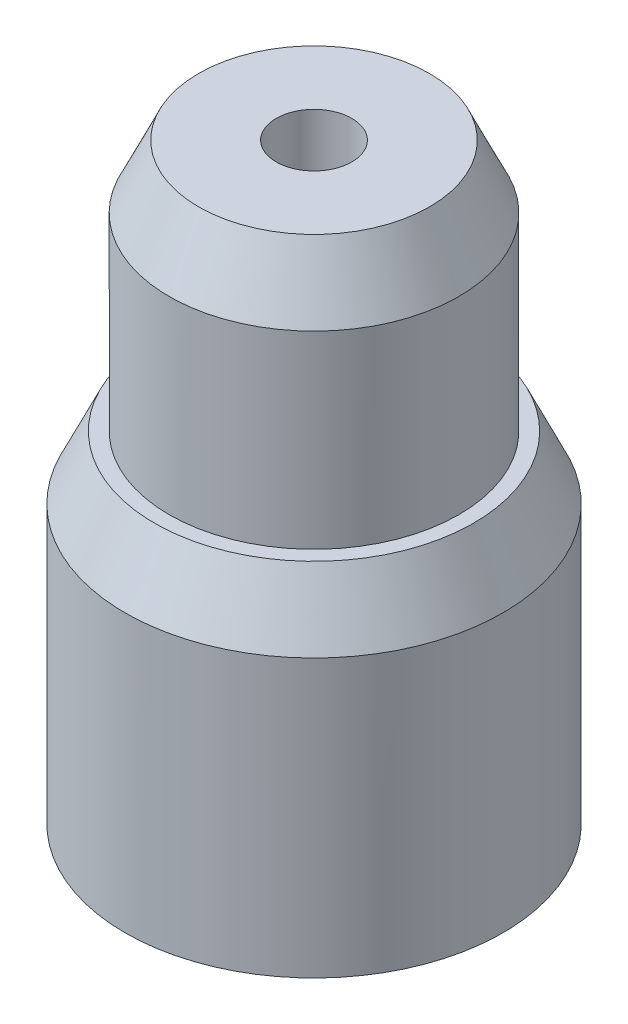
from build123d import *

# Parameters (mm, degrees)
CROQUIS1_R              = 15
SALIENTE_EXTRUIR1_DEPTH = 27
CROQUIS2_R              = 11.5
SALIENTE_EXTRUIR2_DEPTH = 20
CHAFL_N1_SIZE           = 5
CHAFL_N1_SIZE2          = 2.331538291
CHAFL_N2_SIZE           = 5
CHAFL_N2_SIZE2          = 2.331538291
CROQUIS3_R              = 5
CORTAR_EXTRUIR1_DEPTH   = 10
CROQUIS4_R              = 3
CORTAR_EXTRUIR2_DEPTH   = 10


with BuildPart() as part:
    # Croquis1 → Saliente-Extruir1 (new body)
    with BuildSketch(Plane(origin=(0, 0, 0), x_dir=(1, 0, 0), z_dir=(0, 1, 0))):
        with Locations(Location((0, 0, 0), (0, 0, 270))):
            Circle(CROQUIS1_R)
    extrude(amount=SALIENTE_EXTRUIR1_DEPTH)

    # Croquis2 → Saliente-Extruir2 (add)
    with BuildSketch(Plane(origin=(0, 27, 0), x_dir=(1, 0, 0), z_dir=(0, 1, 0))):
        with Locations(Location((0, 0, 0), (0, 0, 270))):
            Circle(CROQUIS2_R)
    extrude(amount=SALIENTE_EXTRUIR2_DEPTH)

    # Chaflán1
    chafl_n1_edges = [part.edges().sort_by_distance(p)[0] for p in [
        (0, 47, -11.5),
    ]]
    chafl_n1_side = [part.faces().sort_by_distance(p)[0] for p in [
        (0, 37, -11.5),
    ]]
    chamfer(chafl_n1_edges, length=CHAFL_N1_SIZE, length2=CHAFL_N1_SIZE2, reference=chafl_n1_side[0])

    # Chaflán2
    chafl_n2_edges = [part.edges().sort_by_distance(p)[0] for p in [
        (0, 27, -15),
    ]]
    chafl_n2_side = [part.faces().sort_by_distance(p)[0] for p in [
        (0, 13.5, -15),
    ]]
    chamfer(chafl_n2_edges, length=CHAFL_N2_SIZE, length2=CHAFL_N2_SIZE2, reference=chafl_n2_side[0])

    # Croquis3 → Cortar-Extruir1 (cut)
    with BuildSketch(Plane(origin=(0, 0, 0), x_dir=(-1, 0, 0), z_dir=(0, -1, 0))):
        with Locations(Location((0, 0, 0), (0, 0, 90))):
            Circle(CROQUIS3_R)
    extrude(amount=-CORTAR_EXTRUIR1_DEPTH, mode=Mode.SUBTRACT)

    # Croquis4 → Cortar-Extruir2 (cut)
    with BuildSketch(Plane(origin=(0, 47, 0), x_dir=(1, 0, 0), z_dir=(0, 1, 0))):
        with Locations(Location((0, 0, 0), (0, 0, 270))):
            Circle(CROQUIS4_R)
    extrude(amount=-CORTAR_EXTRUIR2_DEPTH, mode=Mode.SUBTRACT)


solid = part.part
